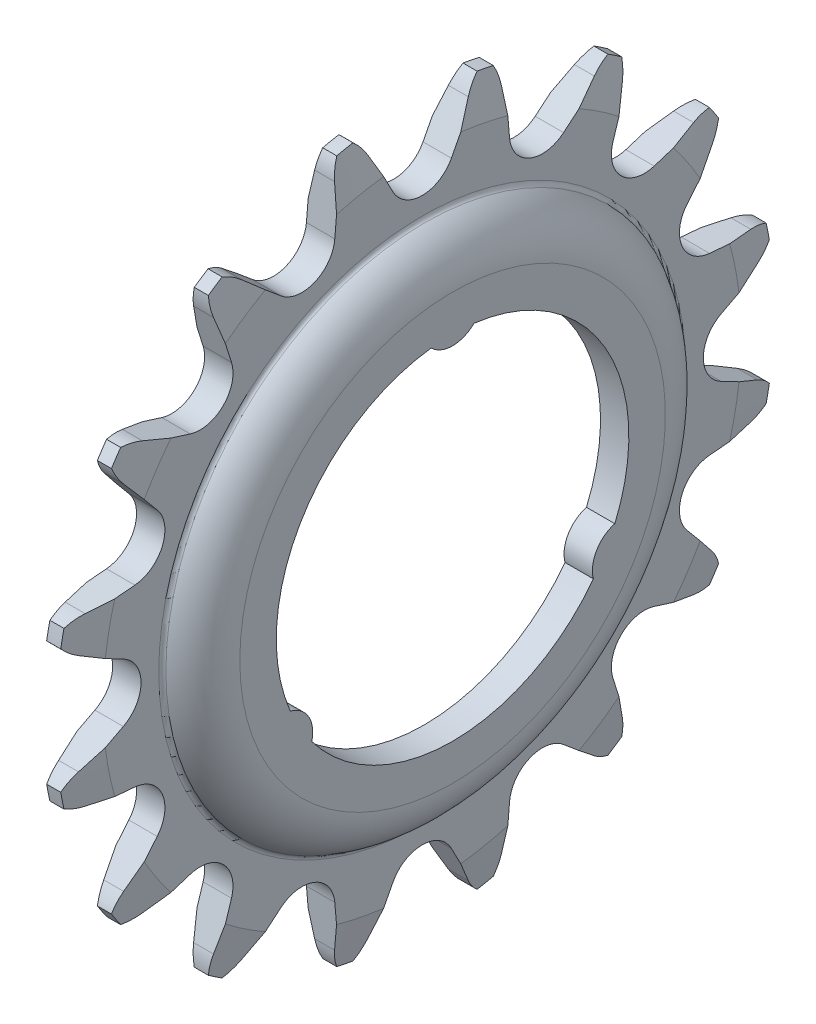
from build123d import *
from OCP.BRepFilletAPI import BRepFilletAPI_MakeChamfer

# Parameters (mm, degrees)
SKIZZE1_R                       = 35.5
SKIZZE1_R_2                     = 26
AUFSATZ_LINEAR_AUSTRAGEN1_DEPTH = 2.8
FASE1_SIZE                      = 4
FASE1_SIZE2                     = 0.705307923
SCHNITT_LINEAR_AUSTRAGEN1_DEPTH = 51.282601365
KREISMUSTER1_COUNT              = 16
AUFSATZ_LINEAR_AUSTRAGEN2_DEPTH = 2.8


with BuildPart() as part:
    # Skizze1 → Aufsatz-Linear austragen1 (new body)
    with BuildSketch(Plane(origin=(0, 0, 0), x_dir=(0, 0, -1), z_dir=(1, 0, 0))):
        Circle(SKIZZE1_R)
        Circle(SKIZZE1_R_2, mode=Mode.SUBTRACT)
    extrude(amount=AUFSATZ_LINEAR_AUSTRAGEN1_DEPTH)

    # Fase1: one chamfer whose edges measure the first distance from different faces: ONE call of the kernel's chamfer builder (chamfer() names one face for all edges)
    fase1_edges_1 = [part.edges().sort_by_distance(p)[0] for p in [
        (0, 0, 35.5),
    ]]
    fase1_side_1 = [part.faces().sort_by_distance(p)[0] for p in [
        (0, 0, 34.495908371),
    ]]
    fase1_edges_2 = [part.edges().sort_by_distance(p)[0] for p in [
        (2.8, 0, 35.5),
    ]]
    fase1_side_2 = [part.faces().sort_by_distance(p)[0] for p in [
        (2.8, 0, 34.495908371),
    ]]
    fase1 = BRepFilletAPI_MakeChamfer(part.part.solid().wrapped)
    for e in fase1_edges_1:
        fase1.Add(FASE1_SIZE, FASE1_SIZE2, e.wrapped, fase1_side_1[0].wrapped)  # the first distance lies on this face
    for e in fase1_edges_2:
        fase1.Add(FASE1_SIZE, FASE1_SIZE2, e.wrapped, fase1_side_2[0].wrapped)  # the first distance lies on this face
    add(Compound.cast(fase1.Shape()), mode=Mode.REPLACE)

    # Skizze2 → Schnitt-Linear austragen1 (cut, symmetric)
    with BuildSketch(Plane(origin=(2.8, 0, 0), x_dir=(0, 0, -1), z_dir=(1, 0, 0))):
        with BuildLine():
            Line((-2.882785208, 29.499317007), (-4.965408954, 33.5))
            ThreePointArc((-4.965408954, 33.5), (-6.264566962, 35.085631761), (-8.090811366, 36.01669083))
            Line((-8.090811366, 36.01669083), (-4.190573376, 38.90099114))
            Line((-4.190573376, 38.90099114), (0, 42))
            Line((0, 42), (4.190573376, 38.90099114))
            Line((4.190573376, 38.90099114), (8.090811366, 36.01669083))
            ThreePointArc((8.090811366, 36.01669083), (6.264566962, 35.085631761), (4.965408954, 33.5))
            Line((4.965408954, 33.5), (2.882785208, 29.499317007))
            ThreePointArc((2.882785208, 29.499317007), (0, 27.75), (-2.882785208, 29.499317007))
        make_face()
    schnitt_linear_austragen1 = extrude(amount=SCHNITT_LINEAR_AUSTRAGEN1_DEPTH, both=True, mode=Mode.SUBTRACT)

    # Kreismuster1: Schnitt-Linear austragen1 ×16 about axis
    kreismuster1_axis = Axis((0, 0, 0), (1, 0, 0))
    for i in range(1, KREISMUSTER1_COUNT):
        add(schnitt_linear_austragen1.rotate(kreismuster1_axis, i * 360 / KREISMUSTER1_COUNT), mode=Mode.SUBTRACT)

    # Skizze3 → Rotation1 (revolve)
    with BuildSketch(Plane.XY, mode=Mode.PRIVATE) as rotation1_sk:
        with BuildLine():
            Line((5.8, 17.4), (5.8, 21))
            ThreePointArc((5.8, 21), (5.06371345, 23.65822807), (3.064705882, 25.558823529))
            ThreePointArc((3.064705882, 25.558823529), (2.871253537, 25.742752122), (2.8, 26))
            Line((2.8, 26), (2.8, 27))
            Line((2.8, 27), (0, 27))
            Line((0, 27), (0, 26))
            ThreePointArc((0, 26), (0.733333333, 23.8), (2.64, 22.48))
            ThreePointArc((2.64, 22.48), (2.9, 22.3), (3, 22))
            Line((3, 22), (3, 17.4))
            Line((3, 17.4), (5.8, 17.4))
        make_face()
    revolve(rotation1_sk.sketch.rotate(Axis((0, 0, 0), (1, 0, 0)), 90), axis=Axis((0, 0, 0), (1, 0, 0)))

    # Skizze4 → Aufsatz-Linear austragen2 (add)
    with BuildSketch(Plane.ZY.offset(-3)):
        with BuildLine():
            Line((-3, 19.4), (3, 19.4))
            ThreePointArc((3, 19.4), (0, 16.4), (-3, 19.4))
        make_face()
        with BuildLine():
            Line((18.300892833, -7.101923789), (15.300892833, -12.298076211))
            ThreePointArc((15.300892833, -12.298076211), (14.202816622, -8.2), (18.300892833, -7.101923789))
        make_face()
        with BuildLine():
            Line((-15.300892833, -12.298076211), (-18.300892833, -7.101923789))
            ThreePointArc((-18.300892833, -7.101923789), (-14.202816622, -8.2), (-15.300892833, -12.298076211))
        make_face()
    extrude(amount=-AUFSATZ_LINEAR_AUSTRAGEN2_DEPTH)


solid = part.part
